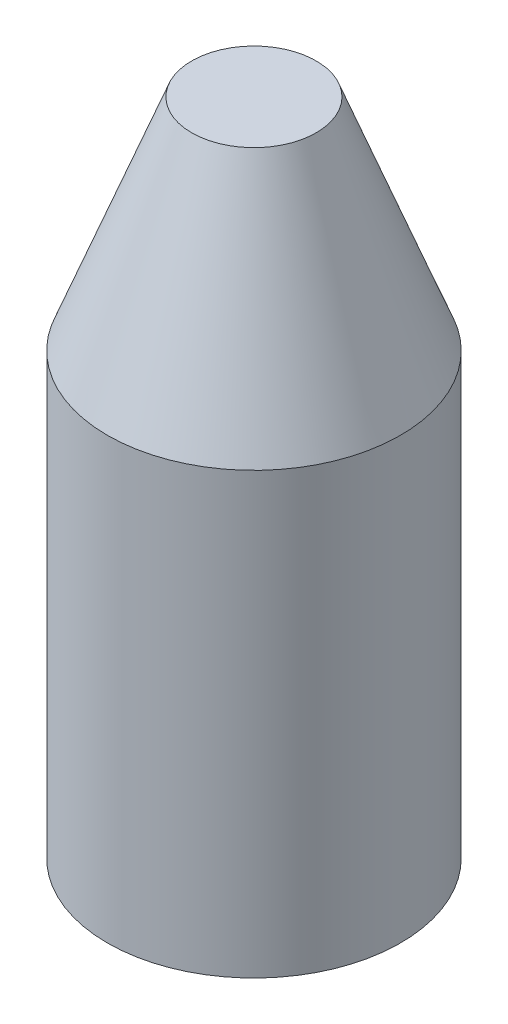
from build123d import *


with BuildPart() as part:
    # Sketch1 → Revolve1 (revolve)
    with BuildSketch(Plane.XY, mode=Mode.PRIVATE) as revolve1_sk:
        Polygon((0, 22.5), (4.248927039, 22.5), (10, 7.5), (10, -22.5), (0, -22.5), align=None)
    revolve(revolve1_sk.sketch.rotate(Axis((0, 22.5, 0), (0, -1, 0)), 90), axis=Axis((0, 22.5, 0), (0, -1, 0)))


solid = part.part
